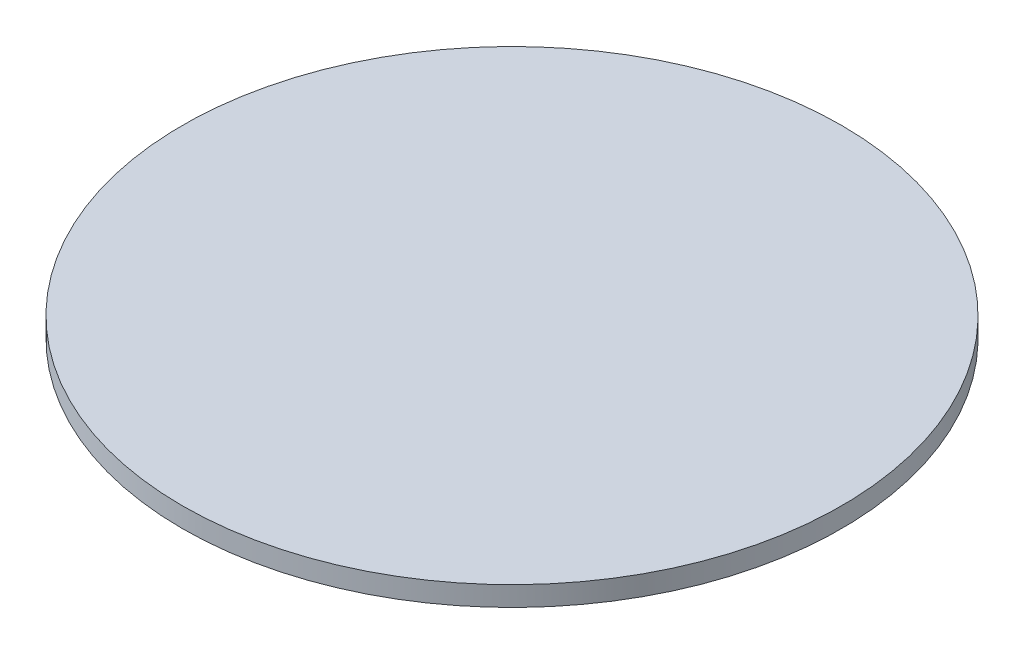
from build123d import *

# Parameters (mm, degrees)
SKETCH1_R           = 50
BOSS_EXTRUDE1_DEPTH = 3
SKETCH2_R           = 4
SKETCH2_R_2         = 2.5
BOSS_EXTRUDE2_DEPTH = 6


with BuildPart() as part:
    # Sketch1 → Boss-Extrude1 (new body)
    with BuildSketch(Plane(origin=(0, 0, 0), x_dir=(1, 0, 0), z_dir=(0, 1, 0))):
        with Locations(Location((0, 0, 0), (0, 0, 270))):
            Circle(SKETCH1_R)
    extrude(amount=BOSS_EXTRUDE1_DEPTH)

    # Sketch2 → Boss-Extrude2 (add)
    with BuildSketch(Plane.XZ):
        with Locations(Location((0, 0, 0), (0, 0, 90))):
            Circle(SKETCH2_R)
        with Locations(Location((0, 0, 0), (0, 0, 270))):
            Circle(SKETCH2_R_2, mode=Mode.SUBTRACT)
    extrude(amount=BOSS_EXTRUDE2_DEPTH)


solid = part.part
